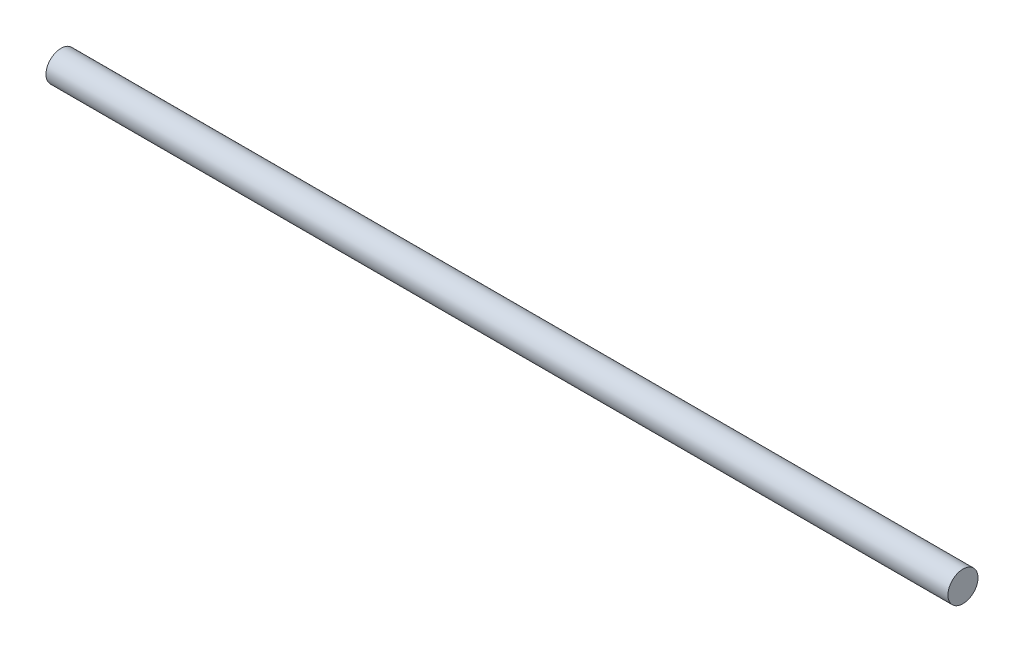
from build123d import *

# Parameters (mm, degrees)
SKETCH1_R           = 2
BOSS_EXTRUDE1_DEPTH = 120


with BuildPart() as part:
    # Sketch1 → Boss-Extrude1 (new body)
    with BuildSketch(Plane(origin=(0, 0, 0), x_dir=(0, 0, -1), z_dir=(1, 0, 0))):
        Circle(SKETCH1_R)
    extrude(amount=BOSS_EXTRUDE1_DEPTH)


solid = part.part
